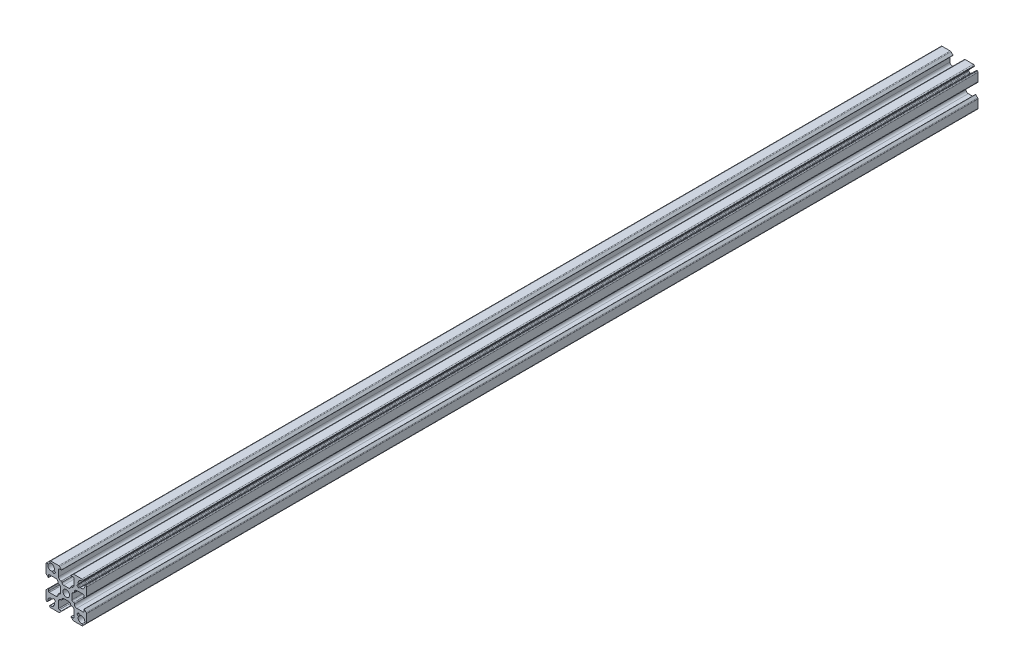
from build123d import *

# Parameters (mm, degrees)
SKETCH1_R           = 2.08
BOSS_EXTRUDE1_DEPTH = 558.8


with BuildPart() as part:
    # Sketch1 → Boss-Extrude1 (new body)
    with BuildSketch(Plane.XY):
        with BuildLine():
            Line((6.985643798, 8.117014648), (7.48853247, 8.61990332))
            ThreePointArc((7.48853247, 8.61990332), (7.554957329, 8.738774884), (7.549228331, 8.874825936))
            ThreePointArc((7.549228331, 8.874825936), (7.955008076, 10.889377278), (9.893284252, 11.572136222))
            ThreePointArc((9.893284252, 11.572136222), (10.383720777, 11.766795458), (10.42656157, 12.292708824))
            ThreePointArc((10.42656157, 12.292708824), (10.150252615, 12.590129525), (9.759440396, 12.7))
            Line((9.759440396, 12.7), (4.710660172, 12.7))
            ThreePointArc((4.710660172, 12.7), (4.423647598, 12.642909649), (4.180330086, 12.480330086))
            Line((4.180330086, 12.480330086), (2.970710678, 11.270710678))
            ThreePointArc((2.970710678, 11.270710678), (2.949033403, 11.161731657), (3.041421356, 11.1))
            Line((3.041421356, 11.1), (4.325, 11.1))
            ThreePointArc((4.325, 11.1), (4.678553391, 10.953553391), (4.825, 10.6))
            Line((4.825, 10.6), (4.825, 6.6))
            ThreePointArc((4.825, 6.6), (4.385660172, 5.539339828), (3.325, 5.1))
            Line((3.325, 5.1), (3.15, 5.1))
            ThreePointArc((3.15, 5.1), (2.796446609, 4.953553391), (2.65, 4.6))
            ThreePointArc((2.65, 4.6), (2.357106781, 3.892893219), (1.65, 3.6))
            Line((1.65, 3.6), (-1.65, 3.6))
            ThreePointArc((-1.65, 3.6), (-2.357106781, 3.892893219), (-2.65, 4.6))
            ThreePointArc((-2.65, 4.6), (-2.796446609, 4.953553391), (-3.15, 5.1))
            Line((-3.15, 5.1), (-3.325, 5.1))
            ThreePointArc((-3.325, 5.1), (-4.385660172, 5.539339828), (-4.825, 6.6))
            Line((-4.825, 6.6), (-4.825, 10.6))
            ThreePointArc((-4.825, 10.6), (-4.678553391, 10.953553391), (-4.325, 11.1))
            Line((-4.325, 11.1), (-3.041421356, 11.1))
            ThreePointArc((-3.041421356, 11.1), (-2.949033403, 11.161731657), (-2.970710678, 11.270710678))
            Line((-2.970710678, 11.270710678), (-4.180330086, 12.480330086))
            ThreePointArc((-4.180330086, 12.480330086), (-4.423647598, 12.642909649), (-4.710660172, 12.7))
            Line((-4.710660172, 12.7), (-9.759440396, 12.7))
            ThreePointArc((-9.759440396, 12.7), (-10.150252615, 12.590129525), (-10.42656157, 12.292708824))
            ThreePointArc((-10.42656157, 12.292708824), (-10.383720777, 11.766795458), (-9.893284252, 11.572136222))
            ThreePointArc((-9.893284252, 11.572136222), (-7.955008076, 10.889377278), (-7.549228331, 8.874825936))
            ThreePointArc((-7.549228331, 8.874825936), (-7.554957329, 8.738774884), (-7.48853247, 8.61990332))
            Line((-7.48853247, 8.61990332), (-6.985643798, 8.117014648))
            ThreePointArc((-6.985643798, 8.117014648), (-6.839197188, 7.763461257), (-6.985643798, 7.409907866))
            Line((-6.985643798, 7.409907866), (-7.409907866, 6.985643798))
            ThreePointArc((-7.409907866, 6.985643798), (-7.763461257, 6.839197188), (-8.117014648, 6.985643798))
            Line((-8.117014648, 6.985643798), (-8.61990332, 7.48853247))
            ThreePointArc((-8.61990332, 7.48853247), (-8.738774884, 7.554957329), (-8.874825936, 7.549228331))
            ThreePointArc((-8.874825936, 7.549228331), (-10.889377278, 7.955008076), (-11.572136222, 9.893284252))
            ThreePointArc((-11.572136222, 9.893284252), (-11.766795458, 10.383720777), (-12.292708824, 10.42656157))
            ThreePointArc((-12.292708824, 10.42656157), (-12.590129525, 10.150252615), (-12.7, 9.759440396))
            Line((-12.7, 9.759440396), (-12.7, 4.710660172))
            ThreePointArc((-12.7, 4.710660172), (-12.642909649, 4.423647598), (-12.480330086, 4.180330086))
            Line((-12.480330086, 4.180330086), (-11.270710678, 2.970710678))
            ThreePointArc((-11.270710678, 2.970710678), (-11.161731657, 2.949033403), (-11.1, 3.041421356))
            Line((-11.1, 3.041421356), (-11.1, 4.325))
            ThreePointArc((-11.1, 4.325), (-10.953553391, 4.678553391), (-10.6, 4.825))
            Line((-10.6, 4.825), (-6.6, 4.825))
            ThreePointArc((-6.6, 4.825), (-5.539339828, 4.385660172), (-5.1, 3.325))
            Line((-5.1, 3.325), (-5.1, 3.15))
            ThreePointArc((-5.1, 3.15), (-4.953553391, 2.796446609), (-4.6, 2.65))
            ThreePointArc((-4.6, 2.65), (-3.892893219, 2.357106781), (-3.6, 1.65))
            Line((-3.6, 1.65), (-3.6, -1.65))
            ThreePointArc((-3.6, -1.65), (-3.892893219, -2.357106781), (-4.6, -2.65))
            ThreePointArc((-4.6, -2.65), (-4.953553391, -2.796446609), (-5.1, -3.15))
            Line((-5.1, -3.15), (-5.1, -3.325))
            ThreePointArc((-5.1, -3.325), (-5.539339828, -4.385660172), (-6.6, -4.825))
            Line((-6.6, -4.825), (-10.6, -4.825))
            ThreePointArc((-10.6, -4.825), (-10.953553391, -4.678553391), (-11.1, -4.325))
            Line((-11.1, -4.325), (-11.1, -3.041421356))
            ThreePointArc((-11.1, -3.041421356), (-11.161731657, -2.949033403), (-11.270710678, -2.970710678))
            Line((-11.270710678, -2.970710678), (-12.480330086, -4.180330086))
            ThreePointArc((-12.480330086, -4.180330086), (-12.642909649, -4.423647598), (-12.7, -4.710660172))
            Line((-12.7, -4.710660172), (-12.7, -9.759440396))
            ThreePointArc((-12.7, -9.759440396), (-12.590129525, -10.150252615), (-12.292708824, -10.42656157))
            ThreePointArc((-12.292708824, -10.42656157), (-11.766795458, -10.383720777), (-11.572136222, -9.893284252))
            ThreePointArc((-11.572136222, -9.893284252), (-10.889377278, -7.955008076), (-8.874825936, -7.549228331))
            ThreePointArc((-8.874825936, -7.549228331), (-8.738774884, -7.554957329), (-8.61990332, -7.48853247))
            Line((-8.61990332, -7.48853247), (-8.117014648, -6.985643798))
            ThreePointArc((-8.117014648, -6.985643798), (-7.763461257, -6.839197188), (-7.409907866, -6.985643798))
            Line((-7.409907866, -6.985643798), (-6.985643798, -7.409907866))
            ThreePointArc((-6.985643798, -7.409907866), (-6.839197188, -7.763461257), (-6.985643798, -8.117014648))
            Line((-6.985643798, -8.117014648), (-7.48853247, -8.61990332))
            ThreePointArc((-7.48853247, -8.61990332), (-7.554957329, -8.738774884), (-7.549228331, -8.874825936))
            ThreePointArc((-7.549228331, -8.874825936), (-7.955008076, -10.889377278), (-9.893284252, -11.572136222))
            ThreePointArc((-9.893284252, -11.572136222), (-10.383720777, -11.766795458), (-10.42656157, -12.292708824))
            ThreePointArc((-10.42656157, -12.292708824), (-10.150252615, -12.590129525), (-9.759440396, -12.7))
            Line((-9.759440396, -12.7), (-4.710660172, -12.7))
            ThreePointArc((-4.710660172, -12.7), (-4.423647598, -12.642909649), (-4.180330086, -12.480330086))
            Line((-4.180330086, -12.480330086), (-2.970710678, -11.270710678))
            ThreePointArc((-2.970710678, -11.270710678), (-2.949033403, -11.161731657), (-3.041421356, -11.1))
            Line((-3.041421356, -11.1), (-4.325, -11.1))
            ThreePointArc((-4.325, -11.1), (-4.678553391, -10.953553391), (-4.825, -10.6))
            Line((-4.825, -10.6), (-4.825, -6.6))
            ThreePointArc((-4.825, -6.6), (-4.385660172, -5.539339828), (-3.325, -5.1))
            Line((-3.325, -5.1), (-3.15, -5.1))
            ThreePointArc((-3.15, -5.1), (-2.796446609, -4.953553391), (-2.65, -4.6))
            ThreePointArc((-2.65, -4.6), (-2.357106781, -3.892893219), (-1.65, -3.6))
            Line((-1.65, -3.6), (1.65, -3.6))
            ThreePointArc((1.65, -3.6), (2.357106781, -3.892893219), (2.65, -4.6))
            ThreePointArc((2.65, -4.6), (2.796446609, -4.953553391), (3.15, -5.1))
            Line((3.15, -5.1), (3.325, -5.1))
            ThreePointArc((3.325, -5.1), (4.385660172, -5.539339828), (4.825, -6.6))
            Line((4.825, -6.6), (4.825, -10.6))
            ThreePointArc((4.825, -10.6), (4.678553391, -10.953553391), (4.325, -11.1))
            Line((4.325, -11.1), (3.041421356, -11.1))
            ThreePointArc((3.041421356, -11.1), (2.949033403, -11.161731657), (2.970710678, -11.270710678))
            Line((2.970710678, -11.270710678), (4.180330086, -12.480330086))
            ThreePointArc((4.180330086, -12.480330086), (4.423647598, -12.642909649), (4.710660172, -12.7))
            Line((4.710660172, -12.7), (9.759440396, -12.7))
            ThreePointArc((9.759440396, -12.7), (10.150252615, -12.590129525), (10.42656157, -12.292708824))
            ThreePointArc((10.42656157, -12.292708824), (10.383720777, -11.766795458), (9.893284252, -11.572136222))
            ThreePointArc((9.893284252, -11.572136222), (7.955008076, -10.889377278), (7.549228331, -8.874825936))
            ThreePointArc((7.549228331, -8.874825936), (7.554957329, -8.738774884), (7.48853247, -8.61990332))
            Line((7.48853247, -8.61990332), (6.985643798, -8.117014648))
            ThreePointArc((6.985643798, -8.117014648), (6.839197188, -7.763461257), (6.985643798, -7.409907866))
            Line((6.985643798, -7.409907866), (7.409907866, -6.985643798))
            ThreePointArc((7.409907866, -6.985643798), (7.763461257, -6.839197188), (8.117014648, -6.985643798))
            Line((8.117014648, -6.985643798), (8.61990332, -7.48853247))
            ThreePointArc((8.61990332, -7.48853247), (8.738774884, -7.554957329), (8.874825936, -7.549228331))
            ThreePointArc((8.874825936, -7.549228331), (10.889377278, -7.955008076), (11.572136222, -9.893284252))
            ThreePointArc((11.572136222, -9.893284252), (11.766795458, -10.383720777), (12.292708824, -10.42656157))
            ThreePointArc((12.292708824, -10.42656157), (12.590129525, -10.150252615), (12.7, -9.759440396))
            Line((12.7, -9.759440396), (12.7, -4.710660172))
            ThreePointArc((12.7, -4.710660172), (12.642909649, -4.423647598), (12.480330086, -4.180330086))
            Line((12.480330086, -4.180330086), (11.270710678, -2.970710678))
            ThreePointArc((11.270710678, -2.970710678), (11.161731657, -2.949033403), (11.1, -3.041421356))
            Line((11.1, -3.041421356), (11.1, -4.325))
            ThreePointArc((11.1, -4.325), (10.953553391, -4.678553391), (10.6, -4.825))
            Line((10.6, -4.825), (6.6, -4.825))
            ThreePointArc((6.6, -4.825), (5.539339828, -4.385660172), (5.1, -3.325))
            Line((5.1, -3.325), (5.1, -3.15))
            ThreePointArc((5.1, -3.15), (4.953553391, -2.796446609), (4.6, -2.65))
            ThreePointArc((4.6, -2.65), (3.892893219, -2.357106781), (3.6, -1.65))
            Line((3.6, -1.65), (3.6, 1.65))
            ThreePointArc((3.6, 1.65), (3.892893219, 2.357106781), (4.6, 2.65))
            ThreePointArc((4.6, 2.65), (4.953553391, 2.796446609), (5.1, 3.15))
            Line((5.1, 3.15), (5.1, 3.325))
            ThreePointArc((5.1, 3.325), (5.539339828, 4.385660172), (6.6, 4.825))
            Line((6.6, 4.825), (10.6, 4.825))
            ThreePointArc((10.6, 4.825), (10.953553391, 4.678553391), (11.1, 4.325))
            Line((11.1, 4.325), (11.1, 3.041421356))
            ThreePointArc((11.1, 3.041421356), (11.161731657, 2.949033403), (11.270710678, 2.970710678))
            Line((11.270710678, 2.970710678), (12.480330086, 4.180330086))
            ThreePointArc((12.480330086, 4.180330086), (12.642909649, 4.423647598), (12.7, 4.710660172))
            Line((12.7, 4.710660172), (12.7, 9.759440396))
            ThreePointArc((12.7, 9.759440396), (12.590129525, 10.150252615), (12.292708824, 10.42656157))
            ThreePointArc((12.292708824, 10.42656157), (11.766795458, 10.383720777), (11.572136222, 9.893284252))
            ThreePointArc((11.572136222, 9.893284252), (10.889377278, 7.955008076), (8.874825936, 7.549228331))
            ThreePointArc((8.874825936, 7.549228331), (8.738774884, 7.554957329), (8.61990332, 7.48853247))
            Line((8.61990332, 7.48853247), (8.117014648, 6.985643798))
            ThreePointArc((8.117014648, 6.985643798), (7.763461257, 6.839197188), (7.409907866, 6.985643798))
            Line((7.409907866, 6.985643798), (6.985643798, 7.409907866))
            ThreePointArc((6.985643798, 7.409907866), (6.839197188, 7.763461257), (6.985643798, 8.117014648))
        make_face()
        Circle(SKETCH1_R, mode=Mode.SUBTRACT)
    extrude(amount=BOSS_EXTRUDE1_DEPTH)


solid = part.part
